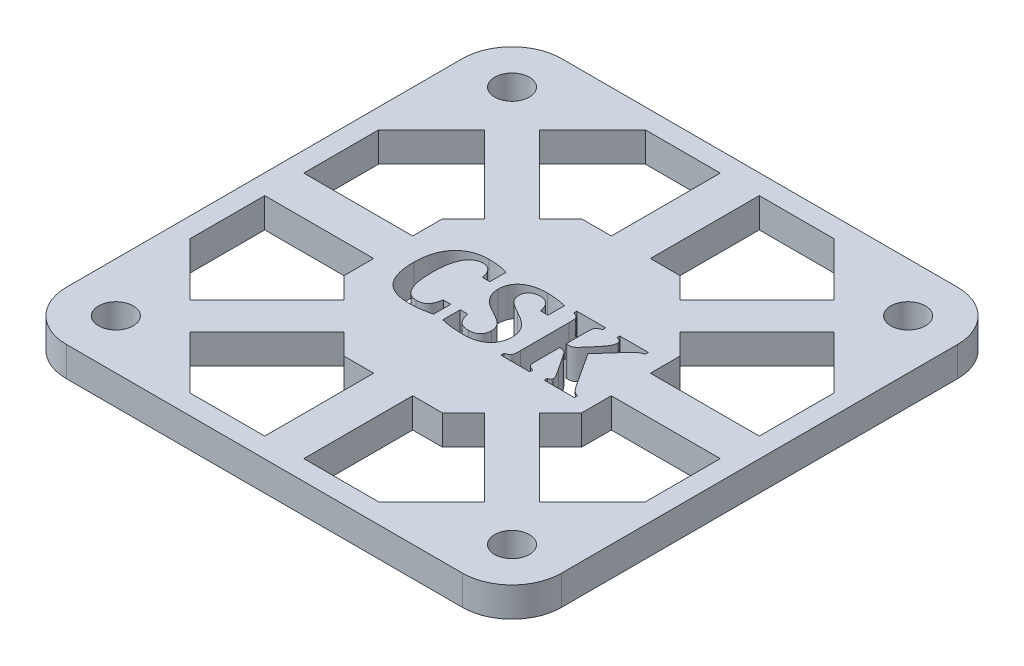
from build123d import *

# Parameters (mm, degrees)
SKETCH1_W           = 50
SKETCH1_H           = 50
BOSS_EXTRUDE1_DEPTH = 3
SKETCH2_R           = 1.75
CUT_EXTRUDE1_DEPTH  = 71.774289117
FILLET1_R           = 5
CUT_EXTRUDE2_DEPTH  = 71.774289117
CIRPATTERN1_COUNT   = 8
CUT_EXTRUDE3_DEPTH  = 71.774289117


with BuildPart() as part:
    # Sketch1 → Boss-Extrude1 (new body)
    with BuildSketch(Plane(origin=(0, 0, 0), x_dir=(1, 0, 0), z_dir=(0, 1, 0))):
        with Locations((25, 25)):
            Rectangle(SKETCH1_W, SKETCH1_H)
    extrude(amount=BOSS_EXTRUDE1_DEPTH)

    # Sketch2 → Cut-Extrude1 (cut, through all)
    with BuildSketch(Plane(origin=(0, 3, 0), x_dir=(1, 0, 0), z_dir=(0, 1, 0))):
        with Locations((5, 5)):
            Circle(SKETCH2_R)
        with Locations((45, 5)):
            Circle(SKETCH2_R)
        with Locations((45, 45)):
            Circle(SKETCH2_R)
        with Locations((5, 45)):
            Circle(SKETCH2_R)
    extrude(amount=-CUT_EXTRUDE1_DEPTH, mode=Mode.SUBTRACT)

    # Fillet1
    fillet1_edges = [part.edges().sort_by_distance(p)[0] for p in [
        (50, 1.5, -50),
        (0, 1.5, -50),
        (50, 1.5, 0),
        (0, 1.5, 0),
    ]]
    fillet(fillet1_edges, radius=FILLET1_R)

    # Sketch4 → Cut-Extrude2 (cut, through all)
    with BuildSketch(Plane(origin=(0, 3, 0), x_dir=(1, 0, 0), z_dir=(0, 1, 0))):
        Polygon((32.091883092, 34.878679656), (39.870057685, 42.656854249), (34.526911935, 48), (26.970562748, 48), (26.970562748, 37), (29.970562748, 37), align=None)
    cut_extrude2 = extrude(amount=-CUT_EXTRUDE2_DEPTH, mode=Mode.SUBTRACT)

    # CirPattern1: Cut-Extrude2 ×8 about axis
    cirpattern1_axis = Axis((25, 3.15, -25), (0, -1, 0))
    for i in range(1, CIRPATTERN1_COUNT):
        add(cut_extrude2.rotate(cirpattern1_axis, i * 360 / CIRPATTERN1_COUNT), mode=Mode.SUBTRACT)

    # Sketch5 → Cut-Extrude3 (cut, through all)
    with BuildSketch(Plane(origin=(0, 3, 0), x_dir=(1, 0, 0), z_dir=(0, 1, 0))):
        with BuildLine():
            Line((20.891594442, 28.521516832), (20.891594442, 26.869150798))
            Line((20.891594442, 26.869150798), (20.144611613, 26.869150798))
            add(Edge.make_bspline(
                [(20.144611613, 26.869150798), (20.121348353, 26.972062029), (20.077440979, 27.166297999), (19.980151472, 27.432286703), (19.865521979, 27.657337678), (19.726352367, 27.838687669), (19.566763202, 27.980801663), (19.381875716, 28.078471137), (19.175186545, 28.139181647), (19.02957735, 28.146104604), (18.95410773, 28.14969279)],
                knots=[0, 0, 0, 0, 1.318127866, 2.487851341, 3.532388156, 4.463771388, 5.33069343, 6.18266645, 7.058071352, 8, 8, 8, 8], degree=3))
            add(Edge.make_bspline(
                [(18.95410773, 28.14969279), (18.882227935, 28.147227592), (18.741744349, 28.142409551), (18.537499596, 28.101792875), (18.347979195, 28.032789146), (18.171156242, 27.937959145), (18.008649592, 27.815388727), (17.861154881, 27.664039831), (17.725311535, 27.488372894), (17.605815724, 27.284265245), (17.498827302, 27.05498255), (17.408424507, 26.798759675), (17.330169908, 26.517406712), (17.265430037, 26.210041429), (17.216059088, 25.876479621), (17.182156892, 25.516920288), (17.159717321, 25.132034562), (17.157713163, 24.866670448), (17.156680298, 24.729912027)],
                knots=[0, 0, 0, 0, 0.800637129, 1.564784294, 2.309424377, 3.041120442, 3.793144549, 4.568458655, 5.389936813, 6.262142842, 7.198837598, 8.205987069, 9.2866366, 10.45176285, 11.704540913, 13.042715489, 14.475929707, 16, 16, 16, 16], degree=3))
            add(Edge.make_bspline(
                [(17.156680298, 24.729912027), (17.157835589, 24.602604323), (17.160077063, 24.35560415), (17.1808434, 23.997453029), (17.2114075, 23.662958587), (17.256137531, 23.352329216), (17.313739879, 23.065399064), (17.385044854, 22.80222242), (17.470196153, 22.563249649), (17.565843295, 22.34695471), (17.675872464, 22.155264548), (17.799240826, 21.989756715), (17.933718704, 21.848255249), (18.082519539, 21.73369726), (18.242756139, 21.64286366), (18.415950031, 21.578267776), (18.601314949, 21.5417104), (18.728854339, 21.536316167), (18.794039981, 21.533559163)],
                knots=[0, 0, 0, 0, 1.530055377, 2.968586589, 4.310691247, 5.566277377, 6.738862084, 7.826318781, 8.840559143, 9.785434891, 10.66542987, 11.491134013, 12.261241907, 13.004184338, 13.740004402, 14.467160996, 15.216562878, 16, 16, 16, 16], degree=3))
            add(Edge.make_bspline(
                [(18.794039981, 21.533559163), (18.859220471, 21.534598135), (18.984153452, 21.536589557), (19.161481328, 21.567046959), (19.322069721, 21.607587248), (19.463335083, 21.67295527), (19.58815319, 21.755732808), (19.699684896, 21.855846954), (19.79906727, 21.972952855), (19.883051483, 22.112346068), (19.958627469, 22.274097689), (20.028172101, 22.463174663), (20.090574857, 22.681961544), (20.125958208, 22.838361837), (20.144611613, 22.920812988)],
                knots=[0, 0, 0, 0, 1.08733336, 2.084117472, 2.998628386, 3.846209617, 4.670273846, 5.492243082, 6.342261939, 7.226091871, 8.202118753, 9.321449096, 10.58792076, 12, 12, 12, 12], degree=3))
            Line((20.144611613, 22.920812988), (20.891594442, 22.920812988))
            Line((20.891594442, 22.920812988), (20.891594442, 21.180076218))
            add(Edge.make_bspline(
                [(20.891594442, 21.180076218), (20.790581887, 21.156088883), (20.59411531, 21.109434192), (20.304072217, 21.051820165), (20.027986475, 21.001127162), (19.674659012, 20.947203593), (19.232587221, 20.902078736), (18.877533823, 20.896247642), (18.697332382, 20.893288167)],
                knots=[0, 0, 0, 0, 0.842330336, 1.638308791, 2.399040171, 3.119740717, 4.538172354, 6, 6, 6, 6], degree=3))
            add(Edge.make_bspline(
                [(18.697332382, 20.893288167), (18.602255119, 20.89452013), (18.415773872, 20.896936459), (18.143047346, 20.917246711), (17.883513422, 20.94996604), (17.637744815, 20.997557324), (17.404025937, 21.053894225), (17.185237154, 21.128754607), (16.97853638, 21.212727717), (16.786437551, 21.313431787), (16.606982609, 21.427394144), (16.439582787, 21.554499584), (16.284066094, 21.695153093), (16.140090295, 21.848594106), (16.009778409, 22.01656929), (15.8911961, 22.197285588), (15.78410288, 22.390978938), (15.690609537, 22.599230841), (15.609607814, 22.821409459), (15.537897524, 23.057419587), (15.475687713, 23.307033107), (15.428447231, 23.571841696), (15.390254438, 23.849981637), (15.361793062, 24.142509984), (15.344977738, 24.449036206), (15.34338958, 24.658193711), (15.342579142, 24.764926847)],
                knots=[0, 0, 0, 0, 1.159635603, 2.274469046, 3.334025084, 4.348550157, 5.326911197, 6.263802524, 7.166539045, 8.045934427, 8.905452706, 9.756992785, 10.606614522, 11.460418623, 12.320230969, 13.196484709, 14.094678295, 15.017108075, 15.978048831, 16.977442302, 18.024869283, 19.113946258, 20.256833539, 21.448855471, 22.698150198, 24, 24, 24, 24], degree=3))
            add(Edge.make_bspline(
                [(15.342579142, 24.764926847), (15.343774872, 24.865563676), (15.346129127, 25.063705988), (15.367255805, 25.35571726), (15.397993176, 25.637972906), (15.443110459, 25.910155244), (15.501169564, 26.172448513), (15.573330951, 26.424358835), (15.656261075, 26.666925961), (15.75279481, 26.898809634), (15.86266512, 27.118822028), (15.985125696, 27.326293929), (16.117900874, 27.52244974), (16.265483442, 27.703423331), (16.422324604, 27.874272798), (16.594629596, 28.028046443), (16.777556652, 28.171130621), (16.972158693, 28.301304761), (17.178990223, 28.415631644), (17.395418527, 28.516687992), (17.621716623, 28.601584156), (17.858974881, 28.669530011), (18.104844092, 28.72501407), (18.361181324, 28.763213185), (18.626939154, 28.784470275), (18.807342084, 28.788111879), (18.899084441, 28.789963786)],
                knots=[0, 0, 0, 0, 1.190524674, 2.344005795, 3.462330608, 4.5488043, 5.606560518, 6.638994431, 7.647593623, 8.638022267, 9.608493659, 10.554712121, 11.486748705, 12.407958682, 13.315263161, 14.22781888, 15.136766144, 16.061443204, 16.994592612, 17.930148599, 18.885282262, 19.850884627, 20.848014252, 21.865428304, 22.91448194, 24, 24, 24, 24], degree=3))
            add(Edge.make_bspline(
                [(18.899084441, 28.789963786), (18.991915726, 28.789495527), (19.172655263, 28.788583843), (19.437353584, 28.776523507), (19.68826443, 28.757242269), (20.009209642, 28.718033234), (20.411835875, 28.650873159), (20.728818688, 28.565405727), (20.891594442, 28.521516832)],
                knots=[0, 0, 0, 0, 0.82813278, 1.612347977, 2.363445611, 3.072583796, 4.496724877, 6, 6, 6, 6], degree=3))
        make_face()
        with BuildLine():
            add(Edge.make_bspline(
                [(22.598983765, 22.920812988), (22.611117622, 22.863966936), (22.63471243, 22.753427348), (22.679880231, 22.594735166), (22.731544518, 22.447892374), (22.788623934, 22.31218803), (22.849722797, 22.185859536), (22.919257627, 22.071609321), (22.995390638, 21.969081432), (23.075100005, 21.875905782), (23.164975573, 21.794231351), (23.265500339, 21.725227928), (23.373904867, 21.66339707), (23.493982567, 21.618655801), (23.621464643, 21.578395022), (23.759842013, 21.553540552), (23.907400896, 21.535638201), (24.008963666, 21.534265907), (24.061269347, 21.533559163)],
                knots=[0, 0, 0, 0, 1.24886554, 2.428472656, 3.54284518, 4.592074114, 5.590943775, 6.555741489, 7.461117158, 8.333021556, 9.187072751, 10.061835725, 10.949308179, 11.860886467, 12.809279934, 13.81887478, 14.876702152, 16, 16, 16, 16], degree=3))
            add(Edge.make_bspline(
                [(24.061269347, 21.533559163), (24.116371399, 21.534631977), (24.224247477, 21.536732279), (24.381109382, 21.5592085), (24.529826388, 21.594165307), (24.669956309, 21.643245435), (24.799392926, 21.710119324), (24.915749606, 21.794400352), (25.018937648, 21.895864897), (25.10748724, 22.014857761), (25.180028469, 22.151040779), (25.231467151, 22.3041573), (25.261598955, 22.473329652), (25.265006809, 22.591101085), (25.266779582, 22.652366034)],
                knots=[0, 0, 0, 0, 1.062149491, 2.079423874, 3.049276155, 4.005464921, 4.935640425, 5.849110802, 6.766347565, 7.716145188, 8.699237381, 9.729811501, 10.819043139, 12, 12, 12, 12], degree=3))
            add(Edge.make_bspline(
                [(25.266779582, 22.652366034), (25.265387925, 22.70973497), (25.262698329, 22.820609518), (25.236029351, 22.98075833), (25.198154095, 23.130200549), (25.137197603, 23.267691398), (25.061210031, 23.398480199), (24.964869968, 23.523906454), (24.848942281, 23.645938423), (24.711000253, 23.765593381), (24.549964094, 23.885935691), (24.36090314, 24.007555925), (24.145066726, 24.134384788), (23.988359551, 24.214419171), (23.906203715, 24.256378269)],
                knots=[0, 0, 0, 0, 0.922451525, 1.782783555, 2.607354513, 3.396673273, 4.194462227, 5.037127191, 5.935674212, 6.899196258, 7.972633037, 9.168530523, 10.515564188, 12, 12, 12, 12], degree=3))
            add(Edge.make_bspline(
                [(23.906203715, 24.256378269), (23.764806237, 24.329955753), (23.491320802, 24.472266424), (23.16597585, 24.667238844), (22.930119898, 24.83126478), (22.770598798, 24.959188225), (22.623466346, 25.092179226), (22.489672131, 25.232597295), (22.369587188, 25.379005683), (22.263212383, 25.53211652), (22.172069396, 25.69181427), (22.093555301, 25.858359458), (22.033291461, 26.035061145), (21.990811721, 26.221728301), (21.962656908, 26.418665834), (21.96004906, 26.55336057), (21.958712769, 26.622379684)],
                knots=[0, 0, 0, 0, 2.058134337, 3.980762403, 4.892704019, 5.765863431, 6.619423588, 7.451965296, 8.268009496, 9.062367096, 9.856432837, 10.63991927, 11.43657556, 12.261784146, 13.10931842, 14, 14, 14, 14], degree=3))
            add(Edge.make_bspline(
                [(21.958712769, 26.622379684), (21.959489351, 26.679115342), (21.961015612, 26.790621101), (21.978497601, 26.95437244), (22.005271196, 27.111939264), (22.040824448, 27.263510611), (22.090489393, 27.407927421), (22.147957081, 27.54606414), (22.217296001, 27.677651216), (22.323834426, 27.84423872), (22.484902404, 28.03604178), (22.713661417, 28.238947484), (22.983473435, 28.407585722), (23.287675894, 28.546461755), (23.623412889, 28.656056741), (23.986283814, 28.732450384), (24.373870185, 28.783061484), (24.640789531, 28.787617611), (24.778239473, 28.789963786)],
                knots=[0, 0, 0, 0, 0.677609128, 1.331743105, 1.964914122, 2.586594663, 3.189259492, 3.787407713, 4.372550753, 4.963840737, 6.147333873, 7.351712002, 8.602533565, 9.93358942, 11.338413031, 12.812781261, 14.358743813, 16, 16, 16, 16], degree=3))
            add(Edge.make_bspline(
                [(24.778239473, 28.789963786), (24.940055475, 28.787586402), (25.257023785, 28.782929537), (25.651989176, 28.747346484), (25.967463462, 28.701388594), (26.218755932, 28.660920196), (26.484458733, 28.604330213), (26.666870025, 28.562864832), (26.760745239, 28.5415253)],
                knots=[0, 0, 0, 0, 1.453975289, 2.848074876, 3.559361539, 4.318884407, 5.134839269, 6, 6, 6, 6], degree=3))
            Line((26.760745239, 28.5415253), (26.760745239, 26.869150798))
            Line((26.760745239, 26.869150798), (26.01376241, 26.869150798))
            add(Edge.make_bspline(
                [(26.01376241, 26.869150798), (25.995163542, 26.943301952), (25.95962927, 27.084972254), (25.895455297, 27.283911827), (25.821972907, 27.458364751), (25.741618542, 27.610534609), (25.653417572, 27.742510558), (25.553267057, 27.85441057), (25.443464179, 27.948691043), (25.320472654, 28.023513098), (25.18482964, 28.080138084), (25.034513056, 28.122858278), (24.867249086, 28.144682193), (24.75050319, 28.147980003), (24.689868736, 28.14969279)],
                knots=[0, 0, 0, 0, 1.351731927, 2.582566266, 3.692476948, 4.695010811, 5.621889774, 6.491999059, 7.342740843, 8.172092804, 9.026460568, 9.93507645, 10.927538234, 12, 12, 12, 12], degree=3))
            add(Edge.make_bspline(
                [(24.689868736, 28.14969279), (24.63755628, 28.14854751), (24.534683377, 28.146295307), (24.384691374, 28.124612209), (24.243110163, 28.086996066), (24.110430644, 28.03838495), (23.988548979, 27.974275874), (23.87955405, 27.896274778), (23.785522744, 27.802328672), (23.702271624, 27.69821346), (23.639516804, 27.577748667), (23.591644365, 27.446887888), (23.56562664, 27.303118333), (23.561512816, 27.203831727), (23.559390259, 27.152604103)],
                knots=[0, 0, 0, 0, 1.107629715, 2.178163535, 3.2004193, 4.206274177, 5.164714652, 6.109024293, 7.033082865, 7.972684172, 8.920729027, 9.896367773, 10.914616141, 12, 12, 12, 12], degree=3))
            add(Edge.make_bspline(
                [(23.559390259, 27.152604103), (23.561035797, 27.099166435), (23.564223554, 26.995646292), (23.587571023, 26.845444632), (23.627731089, 26.706678235), (23.683264936, 26.576259356), (23.760833879, 26.454014099), (23.859232694, 26.335820326), (23.97643887, 26.216348682), (24.119203074, 26.098462119), (24.29159872, 25.979930918), (24.492757744, 25.851312009), (24.729586346, 25.71673417), (24.899710991, 25.626494543), (24.989995766, 25.578604571)],
                knots=[0, 0, 0, 0, 0.851659455, 1.649845737, 2.415303784, 3.149355668, 3.90157415, 4.713797267, 5.597124304, 6.565846922, 7.659620595, 8.930263842, 10.370897766, 12, 12, 12, 12], degree=3))
            add(Edge.make_bspline(
                [(24.989995766, 25.578604571), (25.100628158, 25.519629988), (25.312295331, 25.406797), (25.606056414, 25.228776591), (25.862561576, 25.05216588), (26.083838627, 24.87612576), (26.273944488, 24.696953464), (26.437276889, 24.512374721), (26.571411226, 24.316867365), (26.68180465, 24.113340543), (26.765644129, 23.896983525), (26.826295905, 23.66616101), (26.861088818, 23.418199077), (26.865294797, 23.247171652), (26.867457072, 23.159247239)],
                knots=[0, 0, 0, 0, 1.386425634, 2.652575677, 3.796756148, 4.828782941, 5.776721465, 6.682879846, 7.549083738, 8.393417515, 9.238153984, 10.108904681, 11.02779659, 12, 12, 12, 12], degree=3))
            add(Edge.make_bspline(
                [(26.867457072, 23.159247239), (26.863929476, 23.046674242), (26.857082124, 22.828160816), (26.79476889, 22.511772108), (26.695871452, 22.217845895), (26.554078786, 21.949095095), (26.376057743, 21.705595605), (26.158388903, 21.492948111), (25.90481736, 21.308668721), (25.615553635, 21.159199732), (25.29844805, 21.03872078), (24.955146121, 20.954864417), (24.588713169, 20.901707755), (24.336021764, 20.896143803), (24.206330744, 20.893288167)],
                knots=[0, 0, 0, 0, 1.025848756, 1.991256615, 2.929118134, 3.845229946, 4.751696722, 5.669406184, 6.609402694, 7.600361286, 8.630410259, 9.69642111, 10.817714058, 12, 12, 12, 12], degree=3))
            add(Edge.make_bspline(
                [(24.206330744, 20.893288167), (24.011711068, 20.89681066), (23.613574323, 20.904016683), (23.015251879, 20.953393867), (22.423339735, 21.030452631), (22.038871504, 21.112063816), (21.852000936, 21.151730887)],
                knots=[0, 0, 0, 0, 0.984094478, 2.013178619, 3.034306584, 4, 4, 4, 4], degree=3))
            Line((21.852000936, 21.151730887), (21.852000936, 22.920812988))
            Line((21.852000936, 22.920812988), (22.598983765, 22.920812988))
        make_face()
        with BuildLine():
            add(Edge.make_bspline(
                [(34.140535418, 22.46061821), (34.176072386, 22.406684275), (34.243583778, 22.304223224), (34.340198726, 22.158721608), (34.427940503, 22.030416419), (34.530138345, 21.889926432), (34.643062314, 21.745751977), (34.767264569, 21.603359987), (34.885656594, 21.499968542), (35.004798358, 21.420034394), (35.1425682, 21.360632227), (35.242863967, 21.330136736), (35.297691854, 21.313466009)],
                knots=[0, 0, 0, 0, 1.157562726, 2.199081047, 3.130195911, 3.943090728, 5.31208529, 6.41229926, 7.323106242, 8.121530652, 8.973112157, 10, 10, 10, 10], degree=3))
            Line((35.297691854, 21.313466009), (35.297691854, 21))
            Line((35.297691854, 21), (32.24806776, 21))
            Line((32.24806776, 21), (32.24806776, 21.320135498))
            add(Edge.make_bspline(
                [(32.24806776, 21.320135498), (32.277692511, 21.324972356), (32.33199148, 21.333837795), (32.404374743, 21.356034756), (32.462755489, 21.37989357), (32.519202207, 21.419704205), (32.566928037, 21.489719384), (32.572172748, 21.553883248), (32.574872748, 21.58691508)],
                knots=[0, 0, 0, 0, 1.151019885, 2.109695205, 2.902758418, 3.560180175, 4.743970303, 6, 6, 6, 6], degree=3))
            add(Edge.make_bspline(
                [(32.574872748, 21.58691508), (32.573656176, 21.617059488), (32.571218683, 21.677456064), (32.552414948, 21.753408741), (32.531470434, 21.819419936), (32.502707633, 21.877939805), (32.468616702, 21.948176368), (32.420239961, 22.032145504), (32.355700764, 22.139920148), (32.269706693, 22.279717596), (32.154725091, 22.452861436), (32.070711382, 22.580631815), (32.024639861, 22.650698662)],
                knots=[0, 0, 0, 0, 0.745061087, 1.492785606, 1.927906461, 2.45743263, 3.103554135, 3.861339309, 4.85480703, 6.214168036, 7.923921714, 10, 10, 10, 10], degree=3))
            Line((32.024639861, 22.650698662), (31.137597752, 23.99126606))
            add(Edge.make_bspline(
                [(31.137597752, 23.99126606), (31.1115953, 24.029697256), (31.06191393, 24.103125502), (30.989949166, 24.205491833), (30.922155399, 24.294029473), (30.841459516, 24.389458964), (30.74767505, 24.488475779), (30.641910425, 24.560395409), (30.552434879, 24.597559575), (30.475283868, 24.615134946), (30.387653933, 24.627005929), (30.325078071, 24.627790559), (30.292239952, 24.628202311)],
                knots=[0, 0, 0, 0, 1.245053671, 2.378851453, 3.357232014, 4.235594611, 5.733019442, 7.002835127, 7.631494504, 8.322348928, 9.119614106, 10, 10, 10, 10], degree=3))
            Line((30.292239952, 24.628202311), (30.175523885, 24.628202311))
            Line((30.175523885, 24.628202311), (30.175523885, 22.372247473))
            add(Edge.make_bspline(
                [(30.175523885, 22.372247473), (30.176297863, 22.308323017), (30.177792653, 22.184865124), (30.185285339, 22.009557067), (30.199529981, 21.856324162), (30.227193315, 21.7284986), (30.269155001, 21.624538447), (30.328028772, 21.538087081), (30.409246363, 21.468170805), (30.511583897, 21.407259287), (30.639774807, 21.359219007), (30.733860427, 21.333743074), (30.784114806, 21.320135498)],
                knots=[0, 0, 0, 0, 1.397170186, 2.698367697, 3.834594448, 4.756922584, 5.546508072, 6.270990296, 7.019514934, 7.869490627, 8.862021364, 10, 10, 10, 10], degree=3))
            Line((30.784114806, 21.320135498), (30.784114806, 21))
            Line((30.784114806, 21), (27.866213131, 21))
            Line((27.866213131, 21), (27.866213131, 21.320135498))
            add(Edge.make_bspline(
                [(27.866213131, 21.320135498), (27.92890479, 21.33823838), (28.041340719, 21.370705448), (28.190617012, 21.433490963), (28.305385992, 21.514852992), (28.382366502, 21.627482244), (28.431963663, 21.764944282), (28.455043585, 21.934666335), (28.467512452, 22.14136253), (28.46791314, 22.293292401), (28.468134562, 22.377249591)],
                knots=[0, 0, 0, 0, 1.138562446, 2.041983393, 2.81822272, 3.555905379, 4.384929344, 5.348412468, 6.534719759, 8, 8, 8, 8], degree=3))
            Line((28.468134562, 22.377249591), (28.468134562, 27.301000245))
            add(Edge.make_bspline(
                [(28.468134562, 27.301000245), (28.467750356, 27.383293719), (28.467048948, 27.533529073), (28.456090843, 27.73948442), (28.436315651, 27.909562996), (28.38630383, 28.047093807), (28.310628695, 28.160102548), (28.194697061, 28.242995409), (28.045269701, 28.312264174), (27.93023191, 28.344935045), (27.866213131, 28.363116455)],
                knots=[0, 0, 0, 0, 1.43212336, 2.614491164, 3.592878272, 4.398050805, 5.141564571, 5.921458422, 6.843287133, 8, 8, 8, 8], degree=3))
            Line((27.866213131, 28.363116455), (27.866213131, 28.683251953))
            Line((27.866213131, 28.683251953), (30.784114806, 28.683251953))
            Line((30.784114806, 28.683251953), (30.784114806, 28.363116455))
            add(Edge.make_bspline(
                [(30.784114806, 28.363116455), (30.747235338, 28.353175312), (30.677737303, 28.334441583), (30.583534562, 28.299040876), (30.503746793, 28.264661181), (30.421707693, 28.217538406), (30.339699852, 28.149826655), (30.267764422, 28.048512448), (30.22396731, 27.924419573), (30.197923097, 27.805608137), (30.185825731, 27.68913295), (30.179541228, 27.577868805), (30.176811903, 27.446073732), (30.175972929, 27.351577442), (30.175523885, 27.301000245)],
                knots=[0, 0, 0, 0, 0.997876128, 1.880461812, 2.628401592, 3.266367116, 4.349065608, 5.381052737, 6.471135116, 7.764974268, 8.554382902, 9.529577064, 10.677756903, 12, 12, 12, 12], degree=3))
            Line((30.175523885, 27.301000245), (30.175523885, 25.268473307))
            Line((30.175523885, 25.268473307), (30.297242069, 25.268473307))
            add(Edge.make_bspline(
                [(30.297242069, 25.268473307), (30.338971713, 25.268815332), (30.418169424, 25.269464454), (30.529410209, 25.282134747), (30.628042083, 25.297465697), (30.744928046, 25.331683625), (30.885269869, 25.404984325), (31.001572007, 25.498257757), (31.086800316, 25.576569968), (31.141070439, 25.634066251), (31.206191092, 25.70231899), (31.281683017, 25.781998128), (31.364259827, 25.876045411), (31.458326488, 25.981027992), (31.561055771, 26.098948006), (31.705469116, 26.26743691), (31.878638887, 26.470667843), (32.066581385, 26.694959832), (32.219076731, 26.890162249), (32.34463207, 27.054685218), (32.444064147, 27.198345693), (32.52413497, 27.326341148), (32.588328693, 27.441274236), (32.650440098, 27.575496224), (32.702131558, 27.736324517), (32.710745915, 27.866393234), (32.714932028, 27.929599635)],
                knots=[0, 0, 0, 0, 0.793841827, 1.506613776, 2.12935454, 2.691831104, 3.818027523, 5.115372954, 5.519664613, 6.020997883, 6.619725123, 7.315890061, 8.11022533, 9.002092945, 9.999441746, 11.087413123, 13.226644998, 15.082632488, 16.657465926, 17.94197634, 19.022047111, 19.982104979, 20.815573586, 21.525749193, 22.797647172, 24, 24, 24, 24], degree=3))
            add(Edge.make_bspline(
                [(32.714932028, 27.929599635), (32.713535826, 27.96147656), (32.710865851, 28.022435221), (32.684775092, 28.108428516), (32.642712329, 28.183634747), (32.582557903, 28.246450125), (32.50799041, 28.295727476), (32.421052337, 28.336553057), (32.318289147, 28.355643199), (32.245885898, 28.360551547), (32.208050823, 28.363116455)],
                knots=[0, 0, 0, 0, 1.015435912, 1.941831408, 2.839917499, 3.743771255, 4.688846298, 5.681700207, 6.7885482, 8, 8, 8, 8], degree=3))
            Line((32.208050823, 28.363116455), (32.208050823, 28.683251953))
            Line((32.208050823, 28.683251953), (35.084268188, 28.683251953))
            Line((35.084268188, 28.683251953), (35.084268188, 28.351444848))
            add(Edge.make_bspline(
                [(35.084268188, 28.351444848), (35.01703695, 28.336749712), (34.889849387, 28.30894956), (34.739583887, 28.248259383), (34.630513202, 28.183787425), (34.544783986, 28.124662964), (34.453832343, 28.052980301), (34.355449806, 27.967781764), (34.247289694, 27.866788827), (34.129277181, 27.743475065), (33.996219098, 27.600811772), (33.904106184, 27.497394103), (33.85541474, 27.442726898)],
                knots=[0, 0, 0, 0, 1.320738776, 2.4985639, 3.091912414, 3.752368119, 4.49781032, 5.315461738, 6.252168688, 7.339496738, 8.593641896, 10, 10, 10, 10], degree=3))
            Line((33.85541474, 27.442726898), (32.14969279, 25.52191391))
            Line((32.14969279, 25.52191391), (34.140535418, 22.46061821))
        make_face()
    extrude(amount=-CUT_EXTRUDE3_DEPTH, mode=Mode.SUBTRACT)


solid = part.part
